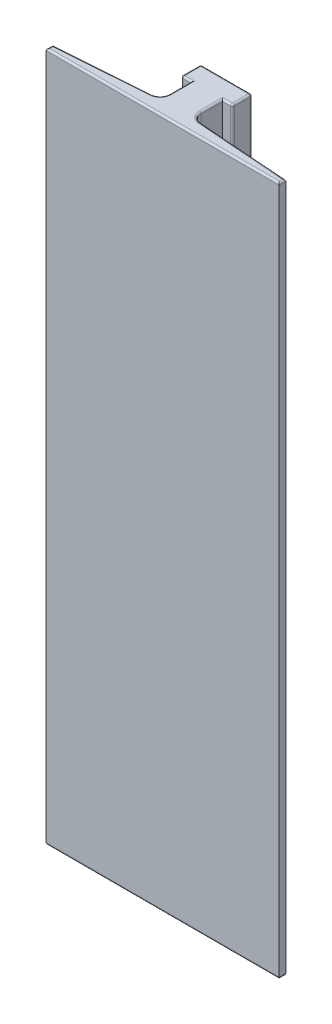
from build123d import *

# Parameters (mm, degrees)
BOSS_EXTRUDE1_DEPTH = 74
FILLET2_R           = 1
FILLET3_R           = 0.2


with BuildPart() as part:
    # Sketch4 → Boss-Extrude1 (new body)
    with BuildSketch(Plane(origin=(0, 0, 0), x_dir=(1, 0, 0), z_dir=(0, 1, 0))):
        Polygon((2.263347742, 4.418167116), (2.263347742, 1.178167116), (13.063347742, 0.388167116), (13.063347742, -0.321832884), (-11.936652258, -0.321832884), (-11.936652258, 0.388167116), (-1.136652258, 1.178167116), (-1.136652258, 4.418167116), (-2.186652258, 4.418167116), (-2.186652258, 6.518167116), (3.313347742, 6.518167116), (3.313347742, 4.418167116), align=None)
    extrude(amount=BOSS_EXTRUDE1_DEPTH)

    # Fillet2
    fillet2_edges = [part.edges().sort_by_distance(p)[0] for p in [
        (-1.136652258, 37, -1.178167116),
        (2.263347742, 37, -1.178167116),
    ]]
    fillet(fillet2_edges, radius=FILLET2_R)

    # Fillet3
    fillet3_edges = [part.edges().sort_by_distance(p)[0] for p in [
        (0.563347742, 74, -6.518167116),
        (-1.136652258, 0, -3.26292892),
        (-7.000175641, 0, -0.749261239),
        (-11.936652258, 0, -0.033167116),
        (0.563347742, 0, 0.321832884),
        (13.063347742, 0, -0.033167116),
        (3.313347742, 74, -5.468167116),
        (2.263347742, 0, -3.26292892),
        (2.788347742, 0, -4.418167116),
        (3.313347742, 0, -5.468167116),
        (0.563347742, 0, -6.518167116),
        (-2.186652258, 0, -5.468167116),
        (-1.661652258, 0, -4.418167116),
        (2.788347742, 74, -4.418167116),
        (2.263347742, 74, -3.26292892),
        (3.313347742, 37, -4.418167116),
        (3.313347742, 37, -6.518167116),
        (-2.186652258, 37, -6.518167116),
        (-2.186652258, 37, -4.418167116),
        (13.063347742, 74, -0.033167116),
        (0.563347742, 74, 0.321832884),
        (-11.936652258, 74, -0.033167116),
        (-7.000175641, 74, -0.749261239),
        (8.126871124, 0, -0.749261239),
        (8.126871124, 74, -0.749261239),
        (-1.136652258, 74, -3.26292892),
        (2.5309021, 0, -1.426865209),
        (2.5309021, 74, -1.426865209),
        (-1.404206617, 0, -1.426865209),
        (-1.404206617, 74, -1.426865209),
        (-1.661652258, 74, -4.418167116),
        (-2.186652258, 74, -5.468167116),
    ]]
    fillet(fillet3_edges, radius=FILLET3_R)


solid = part.part
